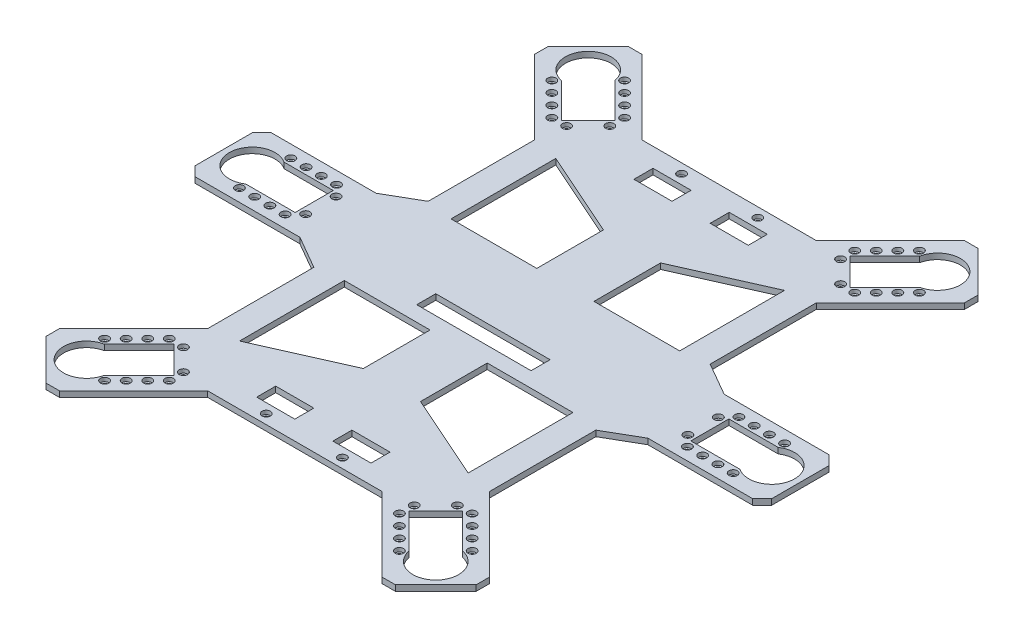
from build123d import *

# Parameters (mm, degrees)
EXTRUDE_1_DEPTH              = 3
CUT_EXTRUDE_1_REACH          = 217.134
HOLE_WIZARD_M2_2_D           = 2.4
HOLE_WIZARD_M2_2_CBORE_D     = 4.4
HOLE_WIZARD_M2_2_CBORE_DEPTH = 2
CUT_EXTRUDE_2_REACH          = 217.134
HOLE_WIZARD_M2_3_D           = 2.4
HOLE_WIZARD_M2_3_CBORE_D     = 4.4
HOLE_WIZARD_M2_3_CBORE_DEPTH = 2
MIRROR_7_COPY_1_REACH        = 217.134
MIRROR_7_COPY_2_D            = 2.4
MIRROR_7_COPY_2_CBORE_D      = 4.4
MIRROR_7_COPY_2_CBORE_DEPTH  = 2
CUT_EXTRUDE_3_REACH          = 217.134
SKETCH_18_W                  = 60
SKETCH_18_H                  = 10
SKETCH_18_W_2                = 20
HOLE_WIZARD_M2_4_D           = 2.4
HOLE_WIZARD_M2_4_CBORE_D     = 4.4
HOLE_WIZARD_M2_4_CBORE_DEPTH = 2


with BuildPart() as part:
    # 草图1 → 凸台-拉伸1 (new body)
    with BuildSketch(Plane(origin=(0, 0, 0), x_dir=(1, 0, 0), z_dir=(0, 1, 0))):
        Polygon((-45.715728753, 114), (45.715728753, 114), (84.606601718, 152.890872965), (91.67766953, 152.890872965), (112.890872965, 131.67766953), (112.890872965, 124.606601718), (74, 85.715728753), (74, 30), (91.320508076, 20), (146.320508076, 20), (151.320508076, 15), (151.320508076, -15), (146.320508076, -20), (91.320508076, -20), (74, -30), (74, -85.715728753), (112.890872965, -124.606601718), (112.890872965, -131.67766953), (91.67766953, -152.890872965), (84.606601718, -152.890872965), (45.715728753, -114), (-45.715728753, -114), (-84.606601718, -152.890872965), (-91.67766953, -152.890872965), (-112.890872965, -131.67766953), (-112.890872965, -124.606601718), (-74, -85.715728753), (-74, -30), (-91.320508076, -20), (-146.320508076, -20), (-151.320508076, -15), (-151.320508076, 15), (-146.320508076, 20), (-91.320508076, 20), (-74, 30), (-74, 85.715728753), (-112.890872965, 124.606601718), (-112.890872965, 131.67766953), (-91.67766953, 152.890872965), (-84.606601718, 152.890872965), align=None)
    extrude(amount=EXTRUDE_1_DEPTH)

    # 草图2 → 切除-拉伸1 (cut, up to next)
    with BuildSketch(Plane(origin=(0, 3, 0), x_dir=(1, 0, 0), z_dir=(0, 1, 0)), mode=Mode.PRIVATE) as cut_extrude_1_sk1:
        with BuildLine():
            Line((103.820508076, -10), (103.820508076, 10))
            Line((103.820508076, 10), (129.687258495, 10))
            ThreePointArc((129.687258495, 10), (148.320508076, 0), (129.687258495, -10))
            Line((129.687258495, -10), (103.820508076, -10))
        make_face()
    cut_extrude_1_tool1 = extrude(cut_extrude_1_sk1.sketch, amount=-CUT_EXTRUDE_1_REACH, mode=Mode.PRIVATE) & part.part
    cut_extrude_1 = cut_extrude_1_tool1.solids().sort_by_distance((125.74589, 3, 0))[0]
    add(cut_extrude_1, mode=Mode.SUBTRACT)

    # M2 凹头盖螺钉的柱形沉头孔2 (through all)
    with Locations(Plane(origin=(100.320508076, 3, -8), x_dir=(0, 0, 1), z_dir=(0, 1, 0))):
        with Locations((0, 0), (-5.5, 5.25), (-5.5, 13.25), (-5.5, 21.25), (-5.5, 29.25), (16, 0), (21.5, 5.25), (21.5, 13.25), (21.5, 21.25), (21.5, 29.25)):
            hole_wizard_m2_2 = CounterBoreHole(HOLE_WIZARD_M2_2_D / 2, HOLE_WIZARD_M2_2_CBORE_D / 2, HOLE_WIZARD_M2_2_CBORE_DEPTH)

    # 草图10 → 切除-拉伸2 (cut, up to next)
    with BuildSketch(Plane(origin=(0, 3, 0), x_dir=(1, 0, 0), z_dir=(0, 1, 0)), mode=Mode.PRIVATE) as cut_extrude_2_sk1:
        with BuildLine():
            Line((75.767766953, 101.625631329), (61.625631329, 115.767766953))
            Line((61.625631329, 115.767766953), (79.916185958, 134.058321582))
            ThreePointArc((79.916185958, 134.058321582), (100.162950904, 140.162950904), (94.058321582, 119.916185958))
            Line((94.058321582, 119.916185958), (75.767766953, 101.625631329))
        make_face()
    cut_extrude_2_tool1 = extrude(cut_extrude_2_sk1.sketch, amount=-CUT_EXTRUDE_2_REACH, mode=Mode.PRIVATE) & part.part
    cut_extrude_2 = cut_extrude_2_tool1.solids().sort_by_distance((84.200285, 3, -124.200285))[0]
    add(cut_extrude_2, mode=Mode.SUBTRACT)

    # M2 凹头盖螺钉的柱形沉头孔3 (through all)
    with Locations(Plane(origin=(60.388194462, 3, -119.480077554), x_dir=(0, 0, 1), z_dir=(0, 1, 0))):
        with Locations((0, 0), (-5.65685425, 5.65685425), (-11.313708499, 11.313708499), (-16.970562749, 16.970562749), (7.601397898, 0.176776695), (18.915106397, 11.490485194), (19.091883092, 19.091883092), (13.435028842, 24.748737342), (7.778174593, 30.405591591), (2.121320343, 36.062445841)):
            hole_wizard_m2_3 = CounterBoreHole(HOLE_WIZARD_M2_3_D / 2, HOLE_WIZARD_M2_3_CBORE_D / 2, HOLE_WIZARD_M2_3_CBORE_DEPTH)

    # 镜向5: 切除-拉伸1, M2 凹头盖螺钉的柱形沉头孔2 across plane
    add(cut_extrude_1.mirror(Plane(origin=(0, 0, 0), x_dir=(0, 0, 1), z_dir=(1, 0, 0))), mode=Mode.SUBTRACT)
    add(hole_wizard_m2_2.mirror(Plane(origin=(0, 0, 0), x_dir=(0, 0, 1), z_dir=(1, 0, 0))), mode=Mode.SUBTRACT)

    # 镜向6: 切除-拉伸2, M2 凹头盖螺钉的柱形沉头孔3 across plane
    add(cut_extrude_2.mirror(Plane(origin=(0, 0, 0), x_dir=(0, 0, 1), z_dir=(1, 0, 0))), mode=Mode.SUBTRACT)
    add(hole_wizard_m2_3.mirror(Plane(origin=(0, 0, 0), x_dir=(0, 0, 1), z_dir=(1, 0, 0))), mode=Mode.SUBTRACT)

    # 镜向7: 切除-拉伸2, M2 凹头盖螺钉的柱形沉头孔3 across plane
    add(cut_extrude_2.mirror(Plane.XY), mode=Mode.SUBTRACT)
    add(hole_wizard_m2_3.mirror(Plane.XY), mode=Mode.SUBTRACT)

    # 镜向7 copy 1 sketch → 镜向7 copy 1 (cut, up to next)
    with BuildSketch(Plane(origin=(0, 3, 0), x_dir=(-1, 0, 0), z_dir=(0, 1, 0)), mode=Mode.PRIVATE) as mirror_7_copy_1_sk1:
        with BuildLine():
            Line((75.767766953, 101.625631329), (61.625631329, 115.767766953))
            Line((61.625631329, 115.767766953), (79.916185958, 134.058321582))
            ThreePointArc((79.916185958, 134.058321582), (100.162950904, 140.162950904), (94.058321582, 119.916185958))
            Line((94.058321582, 119.916185958), (75.767766953, 101.625631329))
        make_face()
    mirror_7_copy_1_tool1 = extrude(mirror_7_copy_1_sk1.sketch, amount=-MIRROR_7_COPY_1_REACH, mode=Mode.PRIVATE) & part.part
    add(mirror_7_copy_1_tool1.solids().sort_by_distance((-84.200285, 3, 124.200285))[0], mode=Mode.SUBTRACT)

    # 镜向7 copy 2 (through all)
    with Locations(Plane(origin=(-60.388194462, 3, 119.480077554), x_dir=(0, 0, -1), z_dir=(0, 1, 0))):
        with Locations((0, 0), (-5.65685425, 5.65685425), (-11.313708499, 11.313708499), (-16.970562749, 16.970562749), (7.601397898, 0.176776695), (18.915106397, 11.490485194), (19.091883092, 19.091883092), (13.435028842, 24.748737342), (7.778174593, 30.405591591), (2.121320343, 36.062445841)):
            CounterBoreHole(MIRROR_7_COPY_2_D / 2, MIRROR_7_COPY_2_CBORE_D / 2, MIRROR_7_COPY_2_CBORE_DEPTH)

    # 草图18 → 切除-拉伸3 (cut, up to next)
    with BuildSketch(Plane(origin=(0, 3, 0), x_dir=(1, 0, 0), z_dir=(0, 1, 0)), mode=Mode.PRIVATE) as cut_extrude_3_sk1:
        Polygon((-60, -28), (-15, -28), (-15, -63), (-60, -83), align=None)
    cut_extrude_3_tool1 = extrude(cut_extrude_3_sk1.sketch, amount=-CUT_EXTRUDE_3_REACH, mode=Mode.PRIVATE) & part.part
    # 草图18 → 切除-拉伸3 (cut, up to next)
    with BuildSketch(Plane(origin=(0, 3, 0), x_dir=(1, 0, 0), z_dir=(0, 1, 0)), mode=Mode.PRIVATE) as cut_extrude_3_sk2:
        with Locations((0, -15)):
            Rectangle(SKETCH_18_W, SKETCH_18_H)
    cut_extrude_3_tool2 = extrude(cut_extrude_3_sk2.sketch, amount=-CUT_EXTRUDE_3_REACH, mode=Mode.PRIVATE) & part.part
    # 草图18 → 切除-拉伸3 (cut, up to next)
    with BuildSketch(Plane(origin=(0, 3, 0), x_dir=(1, 0, 0), z_dir=(0, 1, 0)), mode=Mode.PRIVATE) as cut_extrude_3_sk3:
        with Locations((20, -99)):
            Rectangle(SKETCH_18_W_2, SKETCH_18_H)
    cut_extrude_3_tool3 = extrude(cut_extrude_3_sk3.sketch, amount=-CUT_EXTRUDE_3_REACH, mode=Mode.PRIVATE) & part.part
    # 草图18 → 切除-拉伸3 (cut, up to next)
    with BuildSketch(Plane(origin=(0, 3, 0), x_dir=(1, 0, 0), z_dir=(0, 1, 0)), mode=Mode.PRIVATE) as cut_extrude_3_sk4:
        with Locations((-20, -99)):
            Rectangle(SKETCH_18_W_2, SKETCH_18_H)
    cut_extrude_3_tool4 = extrude(cut_extrude_3_sk4.sketch, amount=-CUT_EXTRUDE_3_REACH, mode=Mode.PRIVATE) & part.part
    # 草图18 → 切除-拉伸3 (cut, up to next)
    with BuildSketch(Plane(origin=(0, 3, 0), x_dir=(1, 0, 0), z_dir=(0, 1, 0)), mode=Mode.PRIVATE) as cut_extrude_3_sk5:
        Polygon((15, -63), (60, -83), (60, -28), (15, -28), align=None)
    cut_extrude_3_tool5 = extrude(cut_extrude_3_sk5.sketch, amount=-CUT_EXTRUDE_3_REACH, mode=Mode.PRIVATE) & part.part
    # 草图18 → 切除-拉伸3 (cut, up to next)
    with BuildSketch(Plane(origin=(0, 3, 0), x_dir=(1, 0, 0), z_dir=(0, 1, 0)), mode=Mode.PRIVATE) as cut_extrude_3_sk6:
        with Locations((-20, 99)):
            Rectangle(SKETCH_18_W_2, SKETCH_18_H)
    cut_extrude_3_tool6 = extrude(cut_extrude_3_sk6.sketch, amount=-CUT_EXTRUDE_3_REACH, mode=Mode.PRIVATE) & part.part
    # 草图18 → 切除-拉伸3 (cut, up to next)
    with BuildSketch(Plane(origin=(0, 3, 0), x_dir=(1, 0, 0), z_dir=(0, 1, 0)), mode=Mode.PRIVATE) as cut_extrude_3_sk7:
        with Locations((20, 99)):
            Rectangle(SKETCH_18_W_2, SKETCH_18_H)
    cut_extrude_3_tool7 = extrude(cut_extrude_3_sk7.sketch, amount=-CUT_EXTRUDE_3_REACH, mode=Mode.PRIVATE) & part.part
    # 草图18 → 切除-拉伸3 (cut, up to next)
    with BuildSketch(Plane(origin=(0, 3, 0), x_dir=(1, 0, 0), z_dir=(0, 1, 0)), mode=Mode.PRIVATE) as cut_extrude_3_sk8:
        Polygon((15, 63), (60, 83), (60, 28), (15, 28), align=None)
    cut_extrude_3_tool8 = extrude(cut_extrude_3_sk8.sketch, amount=-CUT_EXTRUDE_3_REACH, mode=Mode.PRIVATE) & part.part
    # 草图18 → 切除-拉伸3 (cut, up to next)
    with BuildSketch(Plane(origin=(0, 3, 0), x_dir=(1, 0, 0), z_dir=(0, 1, 0)), mode=Mode.PRIVATE) as cut_extrude_3_sk9:
        Polygon((-15, 28), (-15, 63), (-60, 83), (-60, 28), align=None)
    cut_extrude_3_tool9 = extrude(cut_extrude_3_sk9.sketch, amount=-CUT_EXTRUDE_3_REACH, mode=Mode.PRIVATE) & part.part
    add(cut_extrude_3_tool1.solids().sort_by_distance((-39.166667, 3, 50.87037))[0], mode=Mode.SUBTRACT)
    add(cut_extrude_3_tool2.solids().sort_by_distance((0, 3, 15))[0], mode=Mode.SUBTRACT)
    add(cut_extrude_3_tool3.solids().sort_by_distance((20, 3, 99))[0], mode=Mode.SUBTRACT)
    add(cut_extrude_3_tool4.solids().sort_by_distance((-20, 3, 99))[0], mode=Mode.SUBTRACT)
    add(cut_extrude_3_tool5.solids().sort_by_distance((39.166667, 3, 50.87037))[0], mode=Mode.SUBTRACT)
    add(cut_extrude_3_tool6.solids().sort_by_distance((-20, 3, -99))[0], mode=Mode.SUBTRACT)
    add(cut_extrude_3_tool7.solids().sort_by_distance((20, 3, -99))[0], mode=Mode.SUBTRACT)
    add(cut_extrude_3_tool8.solids().sort_by_distance((39.166667, 3, -50.87037))[0], mode=Mode.SUBTRACT)
    add(cut_extrude_3_tool9.solids().sort_by_distance((-39.166667, 3, -50.87037))[0], mode=Mode.SUBTRACT)

    # M2 凹头盖螺钉的柱形沉头孔4 (through all)
    with Locations(Plane(origin=(-20, 3, 109), x_dir=(0, 0, 1), z_dir=(0, 1, 0))):
        with Locations((0, 0), (0, 40), (-218, 0), (-218, 40)):
            CounterBoreHole(HOLE_WIZARD_M2_4_D / 2, HOLE_WIZARD_M2_4_CBORE_D / 2, HOLE_WIZARD_M2_4_CBORE_DEPTH)


solid = part.part
